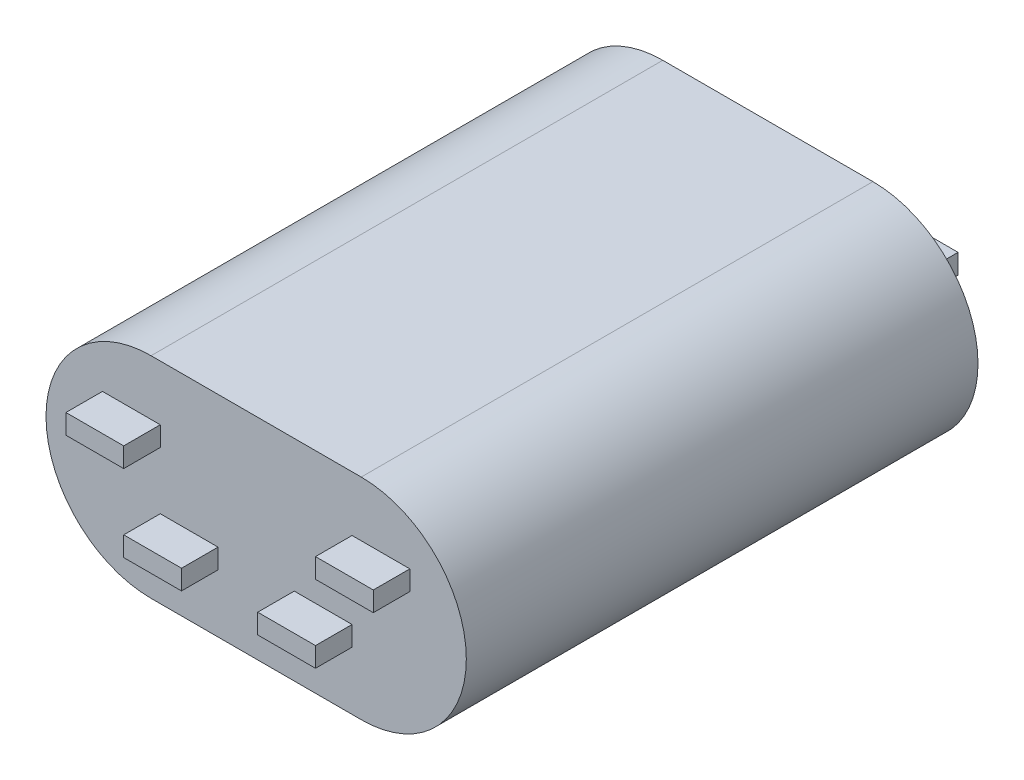
from build123d import *

# Parameters (mm, degrees)
EXTRUDE1_START      = 2
EXTRUDE1_DEPTH      = 28
EXTRUDE2_DEPTH      = 2
EXTRUDE2_DEPTH_BACK = 30
SKETCH4_W           = 3.162406988
SKETCH4_H           = 1.077560899
SKETCH4_H_2         = 1.0775609


with BuildPart() as part:
    # Sketch1 → Extrude1 (new body)
    with BuildSketch(Plane.XY.offset(EXTRUDE1_START)):
        with BuildLine():
            Line((5.75, 14.5), (-5.75, 14.5))
            ThreePointArc((-5.75, 14.5), (-11.5, 8.75), (-5.75, 3))
            Line((-5.75, 3), (5.75, 3))
            ThreePointArc((5.75, 3), (11.5, 8.75), (5.75, 14.5))
        make_face()
    extrude(amount=EXTRUDE1_DEPTH)

    # Sketch4 → Extrude2 (add, two sides: drawn at the far end of the back side and taken through both)
    with BuildSketch(Plane(origin=(0, 0, 2), x_dir=(-1, 0, 0), z_dir=(0, 0, -1)).offset(-EXTRUDE2_DEPTH_BACK)):
        with Locations((-6.82845657, 10.940259655)):
            Rectangle(SKETCH4_W, SKETCH4_H)
        with Locations((-3.666049582, 6.723717004)):
            Rectangle(SKETCH4_W, SKETCH4_H_2)
        with Locations((3.666049582, 6.723717004)):
            Rectangle(SKETCH4_W, SKETCH4_H_2)
        with Locations((6.82845657, 10.940259655)):
            Rectangle(SKETCH4_W, SKETCH4_H)
    extrude(amount=EXTRUDE2_DEPTH + EXTRUDE2_DEPTH_BACK)


solid = part.part
